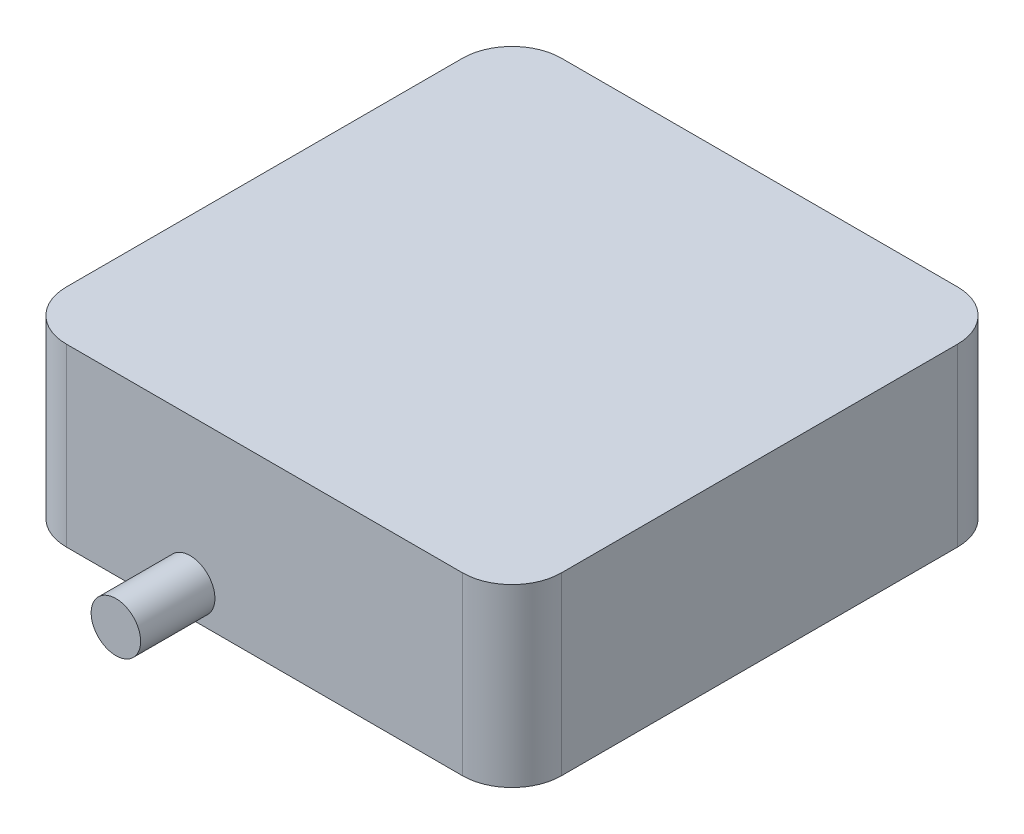
from build123d import *

# Parameters (mm, degrees)
SKETCH1_W           = 200
SKETCH1_H           = 200
BOSS_EXTRUDE1_DEPTH = 71
FILLET1_R           = 20
SKETCH2_R           = 10
BOSS_EXTRUDE2_DEPTH = 30


with BuildPart() as part:
    # Sketch1 → Boss-Extrude1 (new body)
    with BuildSketch(Plane(origin=(0, 0, 0), x_dir=(1, 0, 0), z_dir=(0, 1, 0))):
        Rectangle(SKETCH1_W, SKETCH1_H)
    extrude(amount=BOSS_EXTRUDE1_DEPTH)

    # Fillet1
    fillet1_edges = [part.edges().sort_by_distance(p)[0] for p in [
        (100, 35.5, 100),
        (-100, 35.5, 100),
        (-100, 35.5, -100),
        (100, 35.5, -100),
    ]]
    fillet(fillet1_edges, radius=FILLET1_R)

    # Sketch2 → Boss-Extrude2 (add)
    with BuildSketch(Plane.XY.offset(100)):
        with Locations(Location((-30, 12, 0), (0, 0, 180))):
            Circle(SKETCH2_R)
    extrude(amount=BOSS_EXTRUDE2_DEPTH)


solid = part.part
